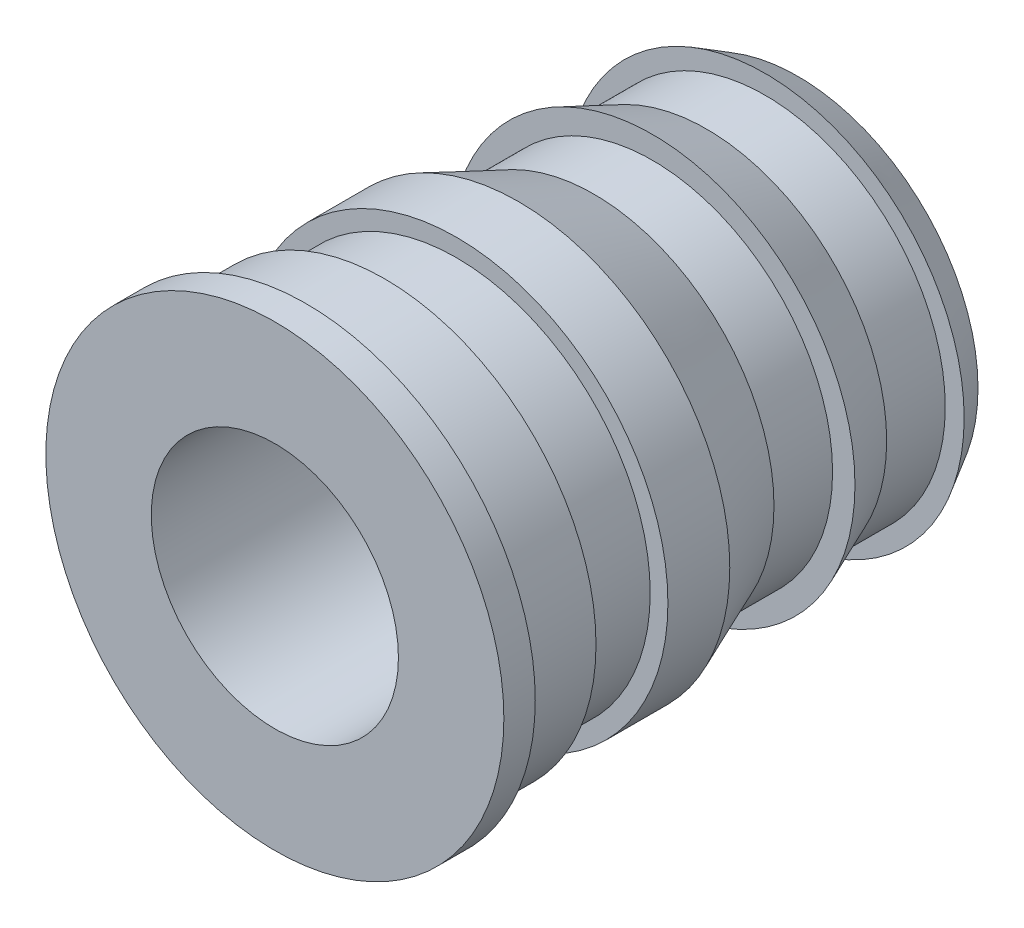
from build123d import *


with BuildPart() as part:
    # Sketch3 → Revolve1 (revolve)
    with BuildSketch(Plane(origin=(0, 0, 0), x_dir=(0, 0, -1), z_dir=(1, 0, 0)), mode=Mode.PRIVATE) as revolve1_sk:
        Polygon((-3.175, 1.5), (-3.175, 2.78), (-2.794, 2.78), (-2.794, 2.565), (-1.8415, 2.565), (-1.8415, 2.35), (-0.968638131, 2.35), (-0.968638131, 2.565), (-0.217694047, 2.565), (0.6985, 2.1855), (1.409664125, 2.1855), (1.409664125, 2.4575), (2.066330214, 2.1855), (2.77749434, 2.1855), (2.77749434, 2.415), (3.175, 2.1855), (3.175, 1.5), align=None)
    revolve(revolve1_sk.sketch.rotate(Axis((0, 0, 3.175), (0, 0, -1)), 90), axis=Axis((0, 0, 3.175), (0, 0, -1)))


solid = part.part
